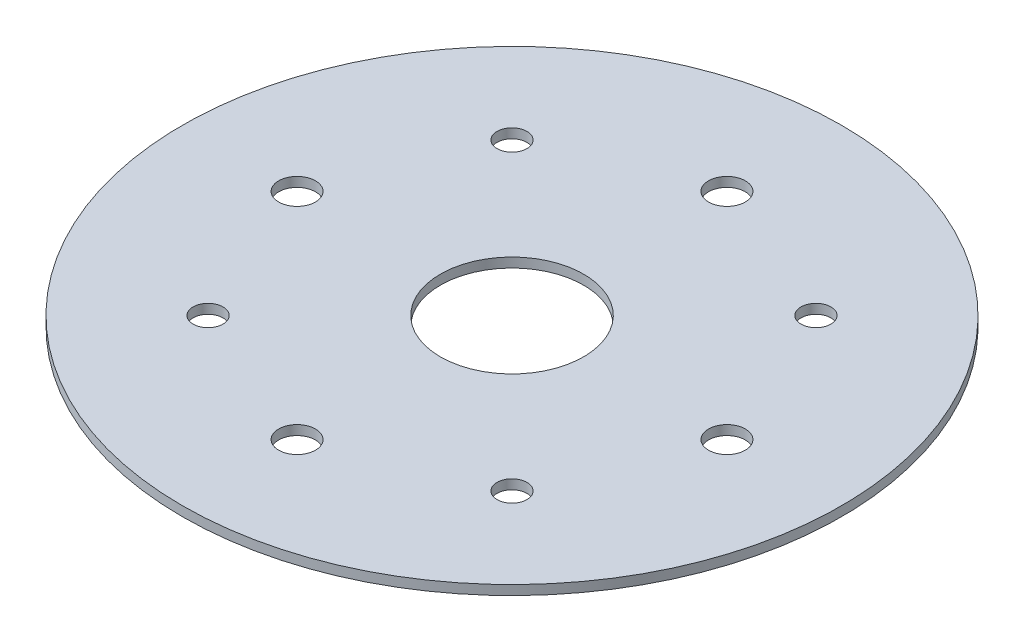
from build123d import *

# Parameters (mm, degrees)
SKETCH1_R           = 34.5
SKETCH1_R_2         = 7.5
SKETCH1_R_3         = 1.5635
SKETCH1_R_4         = 1.925
BOSS_EXTRUDE1_DEPTH = 1


with BuildPart() as part:
    # Sketch1 → Boss-Extrude1 (new body)
    with BuildSketch(Plane(origin=(0, 0, 0), x_dir=(1, 0, 0), z_dir=(0, 1, 0))):
        with Locations(Location((0, 0, 0), (0, 0, 270))):
            Circle(SKETCH1_R)
        with Locations(Location((0, 0, 0), (0, 0, 270))):
            Circle(SKETCH1_R_2, mode=Mode.SUBTRACT)
        with Locations(Location((15.909902577, -15.909902577, 0), (0, 0, 270))):
            Circle(SKETCH1_R_3, mode=Mode.SUBTRACT)
        with Locations(Location((-15.909902577, -15.909902577, 0), (0, 0, 270))):
            Circle(SKETCH1_R_3, mode=Mode.SUBTRACT)
        with Locations(Location((-15.909902577, 15.909902577, 0), (0, 0, 270))):
            Circle(SKETCH1_R_3, mode=Mode.SUBTRACT)
        with Locations(Location((15.909902577, 15.909902577, 0), (0, 0, 270))):
            Circle(SKETCH1_R_3, mode=Mode.SUBTRACT)
        with Locations(Location((22.5, 0, 0), (0, 0, 270))):
            Circle(SKETCH1_R_4, mode=Mode.SUBTRACT)
        with Locations(Location((0, -22.5, 0), (0, 0, 270))):
            Circle(SKETCH1_R_4, mode=Mode.SUBTRACT)
        with Locations(Location((-22.5, 0, 0), (0, 0, 270))):
            Circle(SKETCH1_R_4, mode=Mode.SUBTRACT)
        with Locations(Location((0, 22.5, 0), (0, 0, 270))):
            Circle(SKETCH1_R_4, mode=Mode.SUBTRACT)
    extrude(amount=BOSS_EXTRUDE1_DEPTH)


solid = part.part
